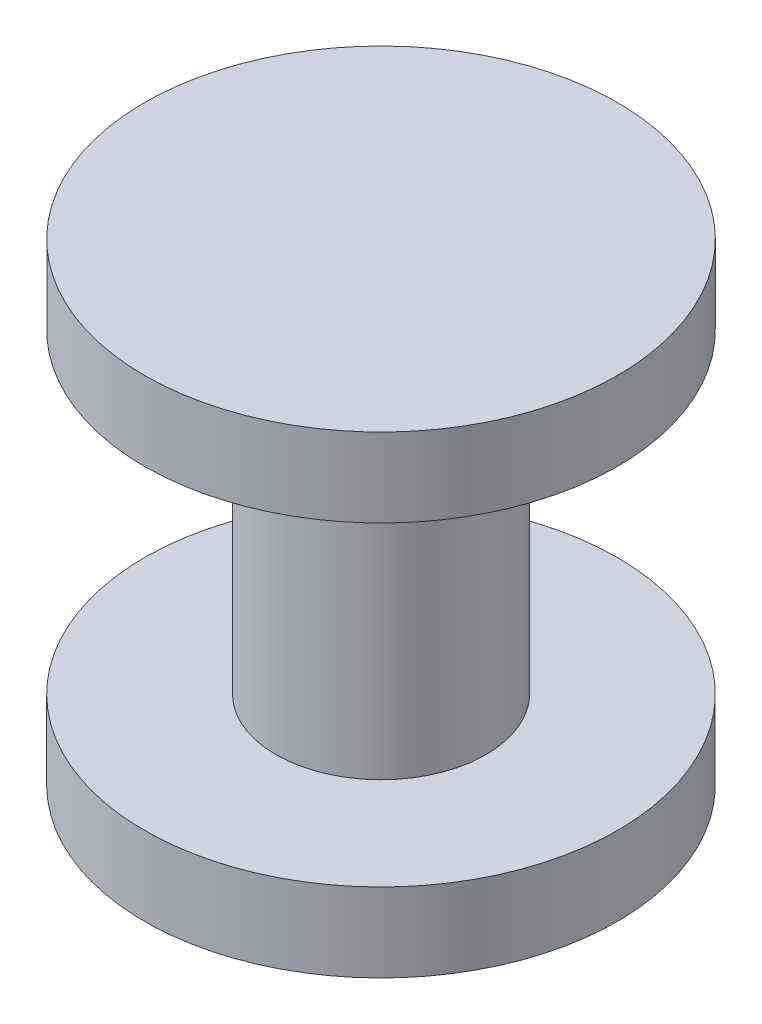
from build123d import *

# Parameters (mm, degrees)
SKETCH1_R           = 2
BOSS_EXTRUDE1_DEPTH = 6
SKETCH2_R           = 4.5
BOSS_EXTRUDE2_DEPTH = 1.5
BOSS_EXTRUDE3_START = 1.5
SKETCH3_R           = 4.5
BOSS_EXTRUDE3_DEPTH = 1.5


with BuildPart() as part:
    # Sketch1 → Boss-Extrude1 (new body)
    with BuildSketch(Plane(origin=(0, 0, 0), x_dir=(1, 0, 0), z_dir=(0, 1, 0))):
        with Locations(Location((0, 0, 0), (0, 0, 270))):
            Circle(SKETCH1_R)
    extrude(amount=BOSS_EXTRUDE1_DEPTH)

    # Sketch2 → Boss-Extrude2 (add)
    with BuildSketch(Plane(origin=(0, 6, 0), x_dir=(1, 0, 0), z_dir=(0, 1, 0))):
        with Locations(Location((0, 0, 0), (0, 0, 270))):
            Circle(SKETCH2_R)
    extrude(amount=BOSS_EXTRUDE2_DEPTH)

    # Sketch3 → Boss-Extrude3 (add)
    with BuildSketch(Plane.XZ.offset(BOSS_EXTRUDE3_START)):
        with Locations(Location((0, 0, 0), (0, 0, 90))):
            Circle(SKETCH3_R)
    extrude(amount=-BOSS_EXTRUDE3_DEPTH)


solid = part.part
